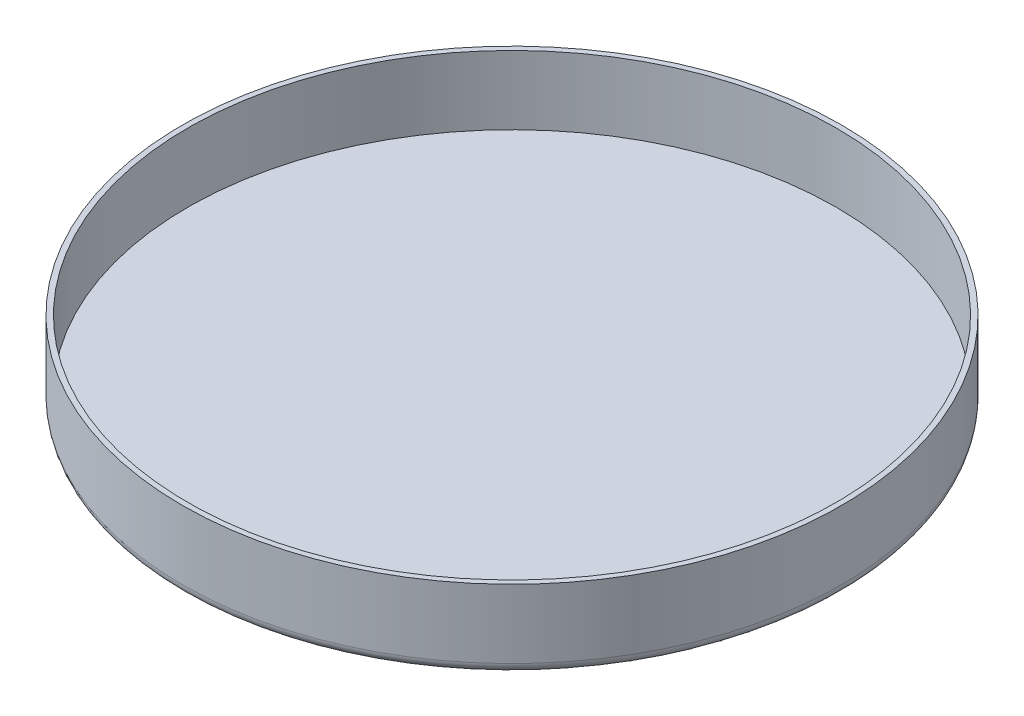
from build123d import *

# Parameters (mm, degrees)
SKETCH1_R           = 79.248
SKETCH1_R_2         = 77.978
BOSS_EXTRUDE1_DEPTH = 19.05
SKETCH2_R           = 77.978
BOSS_EXTRUDE2_DEPTH = 2.54
FILLET1_R           = 2.54


with BuildPart() as part:
    # Sketch1 → Boss-Extrude1 (new body)
    with BuildSketch(Plane(origin=(0, 0, 0), x_dir=(1, 0, 0), z_dir=(0, 1, 0))):
        with Locations(Location((0, 0, 0), (0, 0, 90))):
            Circle(SKETCH1_R)
        with Locations(Location((0, 0, 0), (0, 0, 90))):
            Circle(SKETCH1_R_2, mode=Mode.SUBTRACT)
    extrude(amount=BOSS_EXTRUDE1_DEPTH)

    # Sketch2 → Boss-Extrude2 (add)
    with BuildSketch(Plane(origin=(0, 0, 0), x_dir=(1, 0, 0), z_dir=(0, 1, 0))):
        with Locations(Location((0, 0, 0), (0, 0, 90))):
            Circle(SKETCH2_R)
    extrude(amount=BOSS_EXTRUDE2_DEPTH)

    # Fillet1
    fillet1_edges = [part.edges().sort_by_distance(p)[0] for p in [
        (0, 0, 79.248),
    ]]
    fillet(fillet1_edges, radius=FILLET1_R)


solid = part.part
